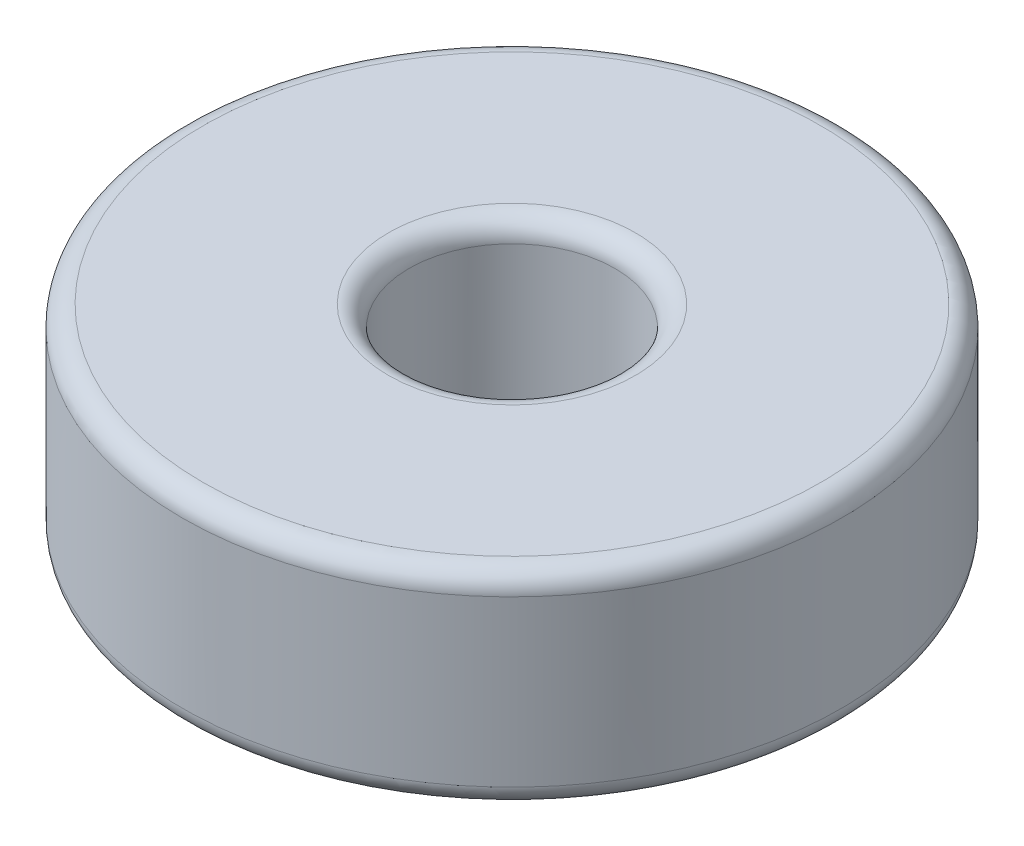
from build123d import *

# Parameters (mm, degrees)
ESQUISSE1_W = 5.5
ESQUISSE1_H = 5
CONG_1_R    = 0.5


with BuildPart() as part:
    # Esquisse1 → Révolution1 (revolve)
    with BuildSketch(Plane.XY, mode=Mode.PRIVATE) as r_volution1_sk:
        with Locations((5.25, 2.5)):
            Rectangle(ESQUISSE1_W, ESQUISSE1_H)
    revolve(r_volution1_sk.sketch.rotate(Axis((0, 0, 0), (0, 1, 0)), 90), axis=Axis((0, 0, 0), (0, 1, 0)))

    # Congé1
    cong_1_edges = [part.edges().sort_by_distance(p)[0] for p in [
        (0, 0, 8),
        (0, 5, 8),
        (0, 5, 2.5),
        (0, 0, 2.5),
    ]]
    fillet(cong_1_edges, radius=CONG_1_R)


solid = part.part
